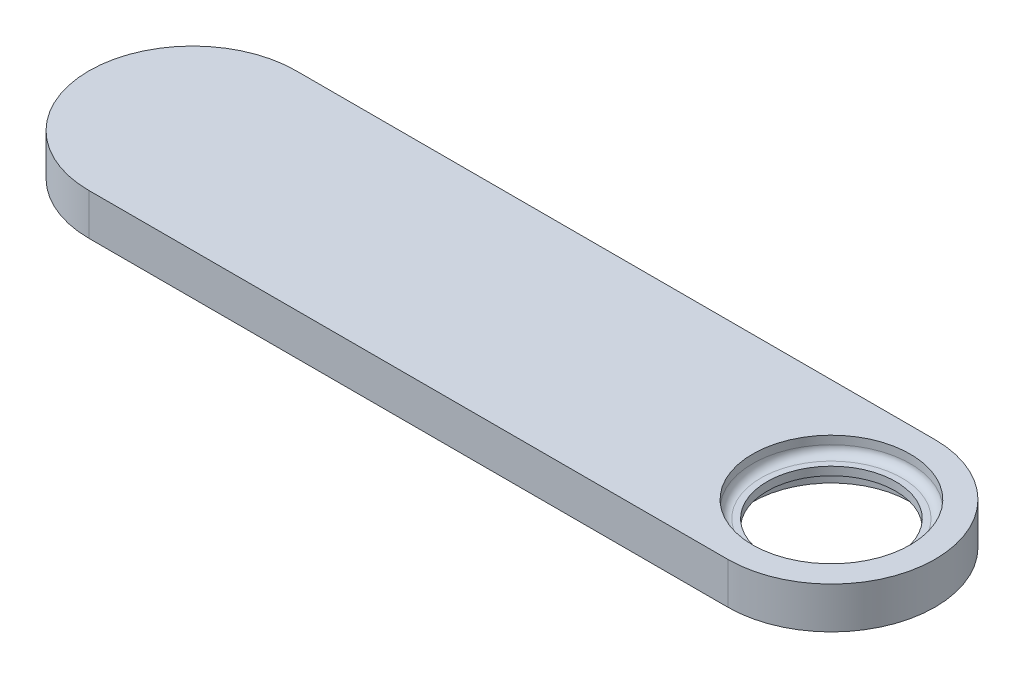
from build123d import *

# Parameters (mm, degrees)
EXTRUDE_1_DEPTH     = 5
CUT_EXTRUDE_1_REACH = 54.767
SKETCH_2_R          = 7.75
SKETCH_3_R          = 9.5
CUT_EXTRUDE_2_DEPTH = 2
CUT_EXTRUDE_START   = -2
SKETCH_4_R          = 9.5
CUT_EXTRUDE_3_DEPTH = 2
FILLET_1_R          = 1


with BuildPart() as part:
    # 草图1 → 凸台-拉伸1 (new body)
    with BuildSketch(Plane(origin=(0, 0, 0), x_dir=(1, 0, 0), z_dir=(0, 1, 0))):
        with BuildLine():
            Line((-38.520408163, 12.5), (38.520408163, 12.5))
            ThreePointArc((38.520408163, 12.5), (51.020408163, 0), (38.520408163, -12.5))
            Line((38.520408163, -12.5), (-38.520408163, -12.5))
            ThreePointArc((-38.520408163, -12.5), (-51.020408163, 0), (-38.520408163, 12.5))
        make_face()
    extrude(amount=EXTRUDE_1_DEPTH)

    # 草图2 → 切除-拉伸1 (cut, up to next)
    with BuildSketch(Plane(origin=(0, 5, 0), x_dir=(1, 0, 0), z_dir=(0, 1, 0)), mode=Mode.PRIVATE) as cut_extrude_1_sk1:
        with Locations(Location((38.520408163, 0, 0), (0, 0, 270))):
            Circle(SKETCH_2_R)
    cut_extrude_1_tool1 = extrude(cut_extrude_1_sk1.sketch, amount=-CUT_EXTRUDE_1_REACH, mode=Mode.PRIVATE) & part.part
    add(cut_extrude_1_tool1.solids().sort_by_distance((38.520408, 5, 0))[0], mode=Mode.SUBTRACT)

    # 草图3 → 切除-拉伸2 (cut)
    with BuildSketch(Plane(origin=(0, 5, 0), x_dir=(1, 0, 0), z_dir=(0, 1, 0))):
        with Locations(Location((38.520408163, 0, 0), (0, 0, 270))):
            Circle(SKETCH_3_R)
    extrude(amount=-CUT_EXTRUDE_2_DEPTH, mode=Mode.SUBTRACT)

    # 草图4 → 切除-拉伸3 (cut)
    with BuildSketch(Plane.XZ.offset(CUT_EXTRUDE_START)):
        with Locations(Location((38.520408163, 0, 0), (0, 0, 90))):
            Circle(SKETCH_4_R)
    extrude(amount=CUT_EXTRUDE_3_DEPTH, mode=Mode.SUBTRACT)

    # 圆角1
    fillet_1_edges = [part.edges().sort_by_distance(p)[0] for p in [
        (38.520408163, 3, -9.5),
        (38.520408163, 2, -9.5),
    ]]
    fillet(fillet_1_edges, radius=FILLET_1_R)


solid = part.part
